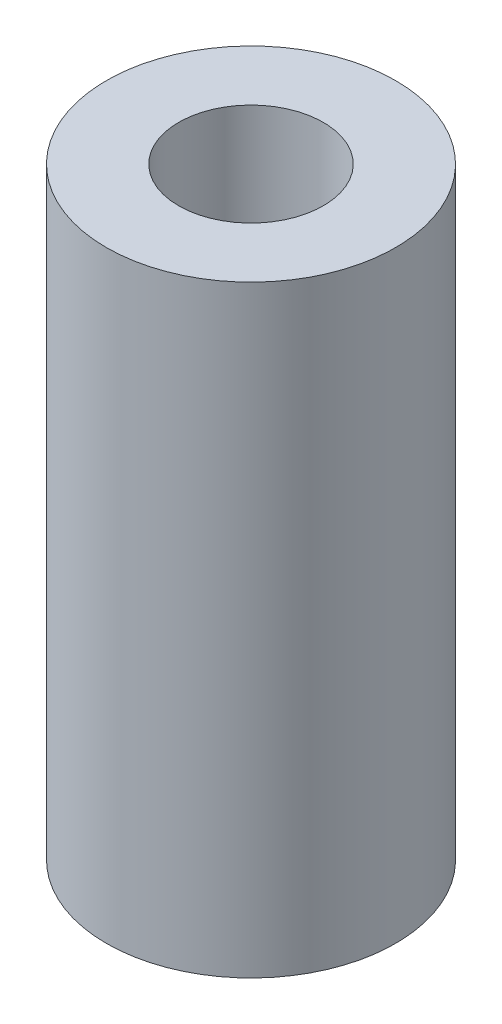
from build123d import *

# Parameters (mm, degrees)
SKETCH1_R      = 3
SKETCH1_R_2    = 1.5
EXTRUDE1_DEPTH = 12.5


with BuildPart() as part:
    # Sketch1 → Extrude1 (new body)
    with BuildSketch(Plane(origin=(0, 0, 0), x_dir=(1, 0, 0), z_dir=(0, 1, 0))):
        with Locations(Location((0, 0, 0), (0, 0, 270))):
            Circle(SKETCH1_R)
        with Locations(Location((0, 0, 0), (0, 0, 270))):
            Circle(SKETCH1_R_2, mode=Mode.SUBTRACT)
    extrude(amount=EXTRUDE1_DEPTH)


solid = part.part
